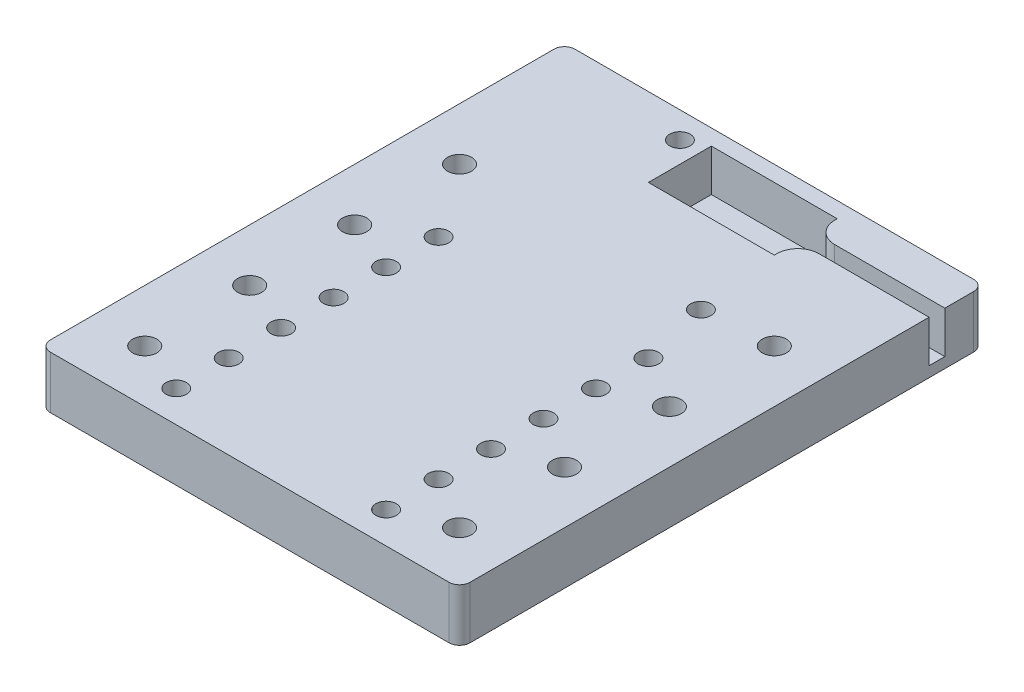
from build123d import *

# Parameters (mm, degrees)
SKETCH1_W           = 40
SKETCH1_H           = 50
BOSS_EXTRUDE1_DEPTH = 5
SKETCH9_R           = 1.15
CUT_EXTRUDE8_DEPTH  = 33.403703492
LPATTERN2_COUNT     = 3
LPATTERN2_PITCH     = 10
LPATTERN2_COL_COUNT = 2
LPATTERN2_COL_PITCH = 10
SKETCH4_R           = 0.975
CUT_EXTRUDE3_DEPTH  = 33.403703492
SKETCH5_R           = 0.975
CUT_EXTRUDE4_DEPTH  = 33.403703492
LPATTERN1_COUNT     = 6
LPATTERN1_PITCH     = 5
FILLET1_R           = 1
CUT_EXTRUDE7_DEPTH  = 4
FILLET2_R           = 2


with BuildPart() as part:
    # Sketch1 → Boss-Extrude1 (new body)
    with BuildSketch(Plane(origin=(0, 0, 0), x_dir=(1, 0, 0), z_dir=(0, 1, 0))):
        Rectangle(SKETCH1_W, SKETCH1_H)
    extrude(amount=BOSS_EXTRUDE1_DEPTH)

    # Sketch9 → Cut-Extrude8 (cut, through all)
    with BuildSketch(Plane(origin=(0, 5, 0), x_dir=(1, 0, 0), z_dir=(0, 1, 0))):
        with Locations(Location((-15, 0, 0), (0, 0, 270))):
            Circle(SKETCH9_R)
        with Locations(Location((15, 0, 0), (0, 0, 90))):
            Circle(SKETCH9_R)
    cut_extrude8 = extrude(amount=-CUT_EXTRUDE8_DEPTH, mode=Mode.SUBTRACT)

    # LPattern2: Cut-Extrude8 ×3
    with Locations(*[(0, 0, i * LPATTERN2_PITCH) for i in range(1, LPATTERN2_COUNT)]):
        add(cut_extrude8, mode=Mode.SUBTRACT)

    # LPattern2 col: Cut-Extrude8 ×2
    with Locations(*[(0, 0, -i * LPATTERN2_COL_PITCH) for i in range(1, LPATTERN2_COL_COUNT)]):
        add(cut_extrude8, mode=Mode.SUBTRACT)

    # Sketch4 → Cut-Extrude3 (cut, through all)
    with BuildSketch(Plane(origin=(0, 5, 0), x_dir=(1, 0, 0), z_dir=(0, 1, 0))):
        with Locations(Location((-6.5, 22.5, 0), (0, 0, 270))):
            Circle(SKETCH4_R)
        with Locations(Location((8.5, 9.5, 0), (0, 0, 270))):
            Circle(SKETCH4_R)
    extrude(amount=-CUT_EXTRUDE3_DEPTH, mode=Mode.SUBTRACT)

    # Sketch5 → Cut-Extrude4 (cut, through all)
    with BuildSketch(Plane(origin=(0, 5, 0), x_dir=(1, 0, 0), z_dir=(0, 1, 0))):
        with Locations(Location((-10, -22, 0), (0, 0, 270))):
            Circle(SKETCH5_R)
        with Locations(Location((10, -22, 0), (0, 0, 90))):
            Circle(SKETCH5_R)
    cut_extrude4 = extrude(amount=-CUT_EXTRUDE4_DEPTH, mode=Mode.SUBTRACT)

    # LPattern1: Cut-Extrude4 ×6
    with Locations(*[(0, 0, -i * LPATTERN1_PITCH) for i in range(1, LPATTERN1_COUNT)]):
        add(cut_extrude4, mode=Mode.SUBTRACT)

    # Fillet1
    fillet1_edges = [part.edges().sort_by_distance(p)[0] for p in [
        (20, 2.5, 25),
        (-20, 2.5, 25),
        (-20, 2.5, -25),
        (20, 2.5, -25),
    ]]
    fillet(fillet1_edges, radius=FILLET1_R)

    # Sketch8 → Cut-Extrude7 (cut)
    with BuildSketch(Plane(origin=(0, 5, 0), x_dir=(1, 0, 0), z_dir=(0, 1, 0))):
        Polygon((7.5, 23.5), (7.5, 21.25), (20, 21.25), (20, 19.75), (7.5, 19.75), (7.5, 17.5), (-4.5, 17.5), (-4.5, 23.5), align=None)
    extrude(amount=-CUT_EXTRUDE7_DEPTH, mode=Mode.SUBTRACT)

    # Fillet2
    fillet2_edges = [part.edges().sort_by_distance(p)[0] for p in [
        (7.5, 3, -19.75),
        (7.5, 3, -21.25),
    ]]
    fillet(fillet2_edges, radius=FILLET2_R)


solid = part.part
